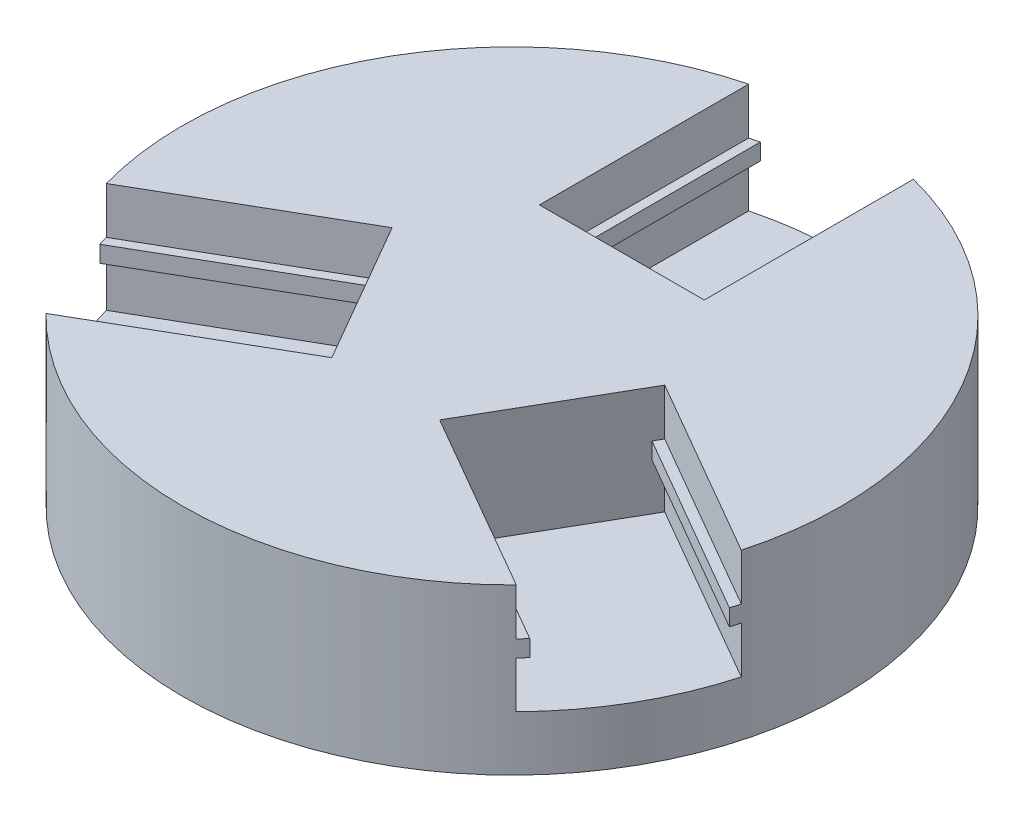
from build123d import *

# Parameters (mm, degrees)
SKETCH1_R           = 30
BOSS_EXTRUDE1_DEPTH = 15
CUT_EXTRUDE1_DEPTH  = 20
CIRPATTERN1_COUNT   = 3


with BuildPart() as part:
    # Sketch1 → Boss-Extrude1 (new body)
    with BuildSketch(Plane(origin=(0, 0, 0), x_dir=(1, 0, 0), z_dir=(0, 1, 0))):
        with Locations(Location((0, 0, 0), (0, 0, 270))):
            Circle(SKETCH1_R)
    extrude(amount=BOSS_EXTRUDE1_DEPTH)

    # Sketch4 → Cut-Extrude1 (cut)
    with BuildSketch(Plane(origin=(0, 15, -30), x_dir=(-1, 0, 0), z_dir=(0, 0, -1))):
        Polygon((-7.5, -10), (-7.5, -5.75), (-6.65, -5.75), (-6.65, -4.25), (-7.5, -4.25), (-7.5, 0), (7.5, 0), (7.5, -4.25), (6.65, -4.25), (6.65, -5.75), (7.5, -5.75), (7.5, -10), align=None)
    cut_extrude1 = extrude(amount=-CUT_EXTRUDE1_DEPTH, mode=Mode.SUBTRACT)

    # CirPattern1: Cut-Extrude1 ×3 about axis
    cirpattern1_axis = Axis((0, 0, 0), (0, 1, 0))
    for i in range(1, CIRPATTERN1_COUNT):
        add(cut_extrude1.rotate(cirpattern1_axis, i * 360 / CIRPATTERN1_COUNT), mode=Mode.SUBTRACT)


solid = part.part
